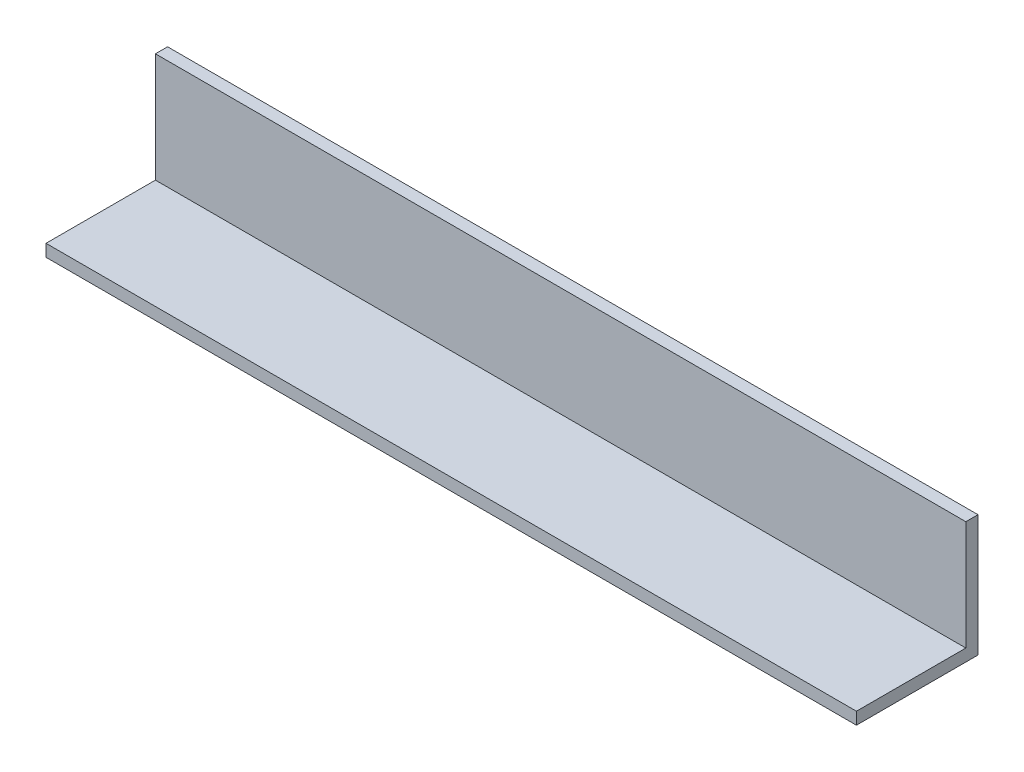
from build123d import *

# Parameters (mm, degrees)
SALIENTE_EXTRUIR1_DEPTH = 100


with BuildPart() as part:
    # Croquis1 → Saliente-Extruir1 (new body)
    with BuildSketch(Plane(origin=(0, 0, 0), x_dir=(0, 0, -1), z_dir=(1, 0, 0))):
        Polygon((0, 0), (-15, 0), (-15, 1.5), (-1.5, 1.5), (-1.5, 15), (0, 15), align=None)
    extrude(amount=SALIENTE_EXTRUIR1_DEPTH)


solid = part.part
